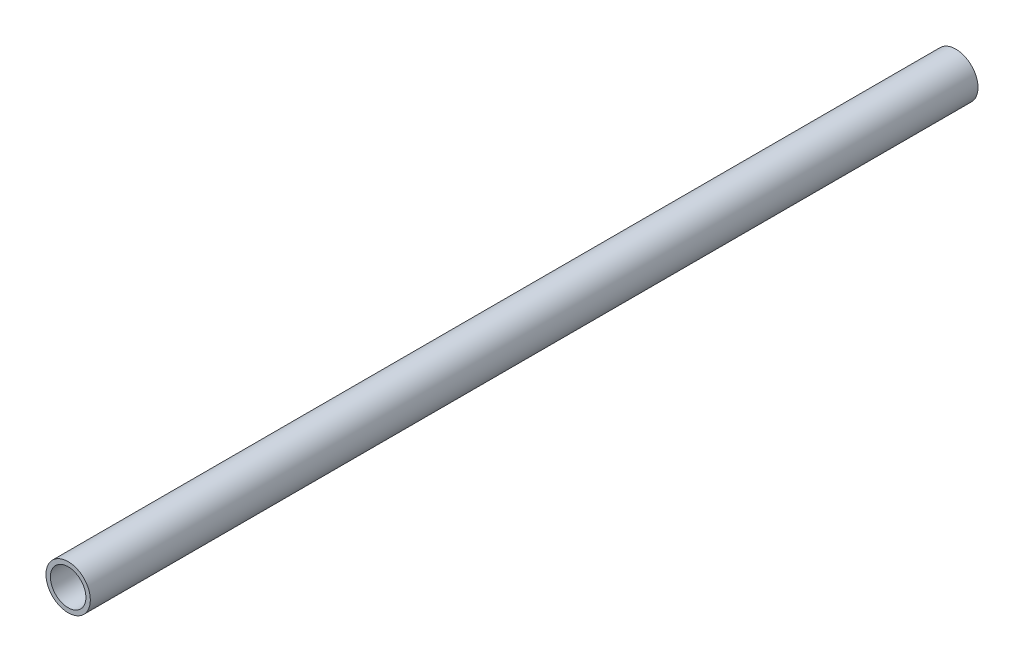
from build123d import *

# Parameters (mm, degrees)
SZKIC1_R                    = 5
SZKIC1_R_2                  = 4
DODANIE_WYCI_GNI_CIE1_DEPTH = 200


with BuildPart() as part:
    # Szkic1 → Dodanie-wyciągnięcie1 (new body)
    with BuildSketch(Plane.XY):
        Circle(SZKIC1_R)
        Circle(SZKIC1_R_2, mode=Mode.SUBTRACT)
    extrude(amount=DODANIE_WYCI_GNI_CIE1_DEPTH)


solid = part.part
